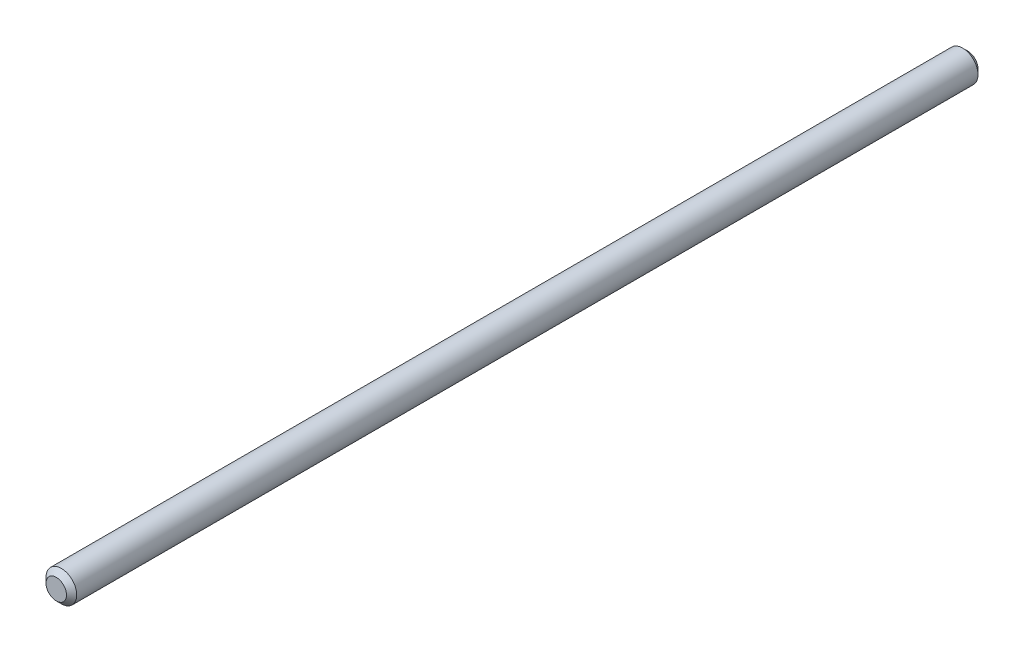
from build123d import *

# Parameters (mm, degrees)
SKETCH1_R           = 3
BOSS_EXTRUDE1_DEPTH = 89
CHAMFER1_SIZE       = 1


with BuildPart() as part:
    # Sketch1 → Boss-Extrude1 (new, symmetric)
    with BuildSketch(Plane.XY):
        Circle(SKETCH1_R)
    extrude(amount=BOSS_EXTRUDE1_DEPTH, both=True)

    # Chamfer1
    chamfer1_edges = [part.edges().sort_by_distance(p)[0] for p in [
        (-3, 0, -89),
        (-3, 0, 89),
    ]]
    chamfer(chamfer1_edges, length=CHAMFER1_SIZE)


solid = part.part
